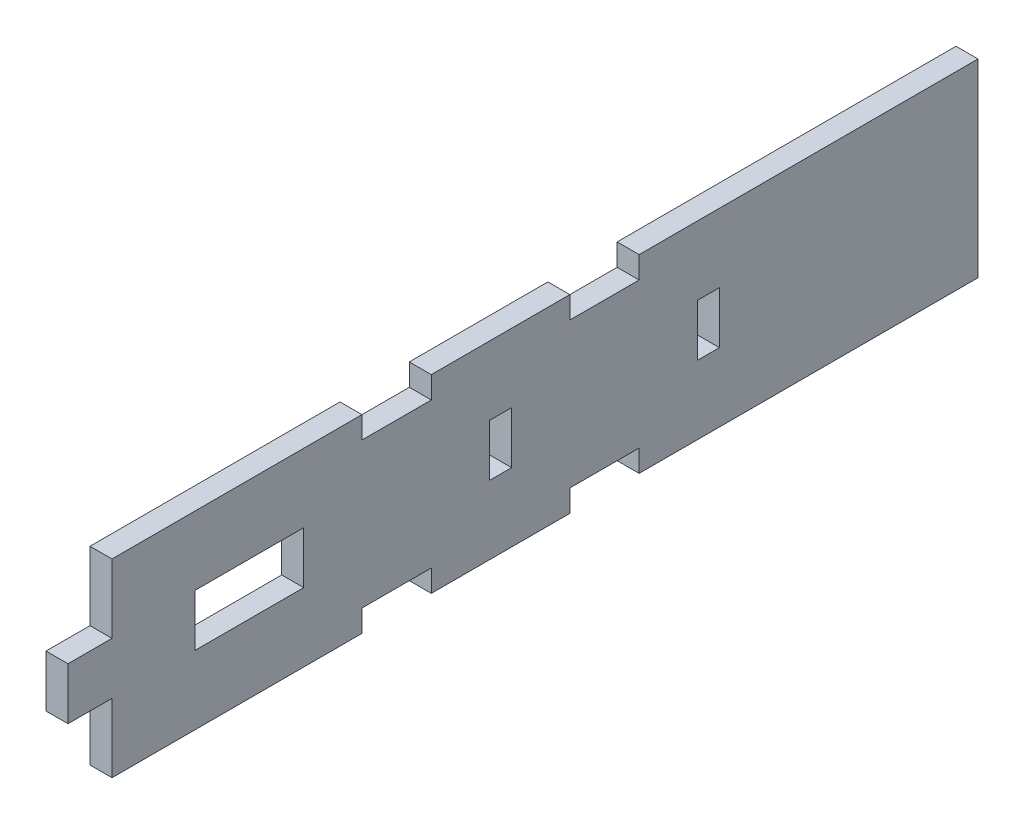
from build123d import *

# Parameters (mm, degrees)
SKETCH1_W           = 250
SKETCH1_H           = 54.7
SKETCH1_W_2         = 12.7
SKETCH1_H_2         = 15
BOSS_EXTRUDE1_DEPTH = 6.35
SKETCH2_W           = 6.35
SKETCH2_H           = 15
CUT_EXTRUDE1_DEPTH  = 141.533394608
LPATTERN1_COUNT     = 3
LPATTERN1_PITCH     = 60
SKETCH3_W           = 25
SKETCH3_H           = 15
CUT_EXTRUDE2_DEPTH  = 141.533394608
SKETCH4_W           = 20
SKETCH4_H           = 6.35
CUT_EXTRUDE3_DEPTH  = 141.533394608


with BuildPart() as part:
    # Sketch1 → Boss-Extrude1 (new body)
    with BuildSketch(Plane(origin=(0, 0, 0), x_dir=(0, 0, -1), z_dir=(1, 0, 0))):
        Rectangle(SKETCH1_W, SKETCH1_H)
        with Locations((-131.35, 0)):
            Rectangle(SKETCH1_W_2, SKETCH1_H_2)
    extrude(amount=BOSS_EXTRUDE1_DEPTH)

    # Sketch2 → Cut-Extrude1 (cut, through all)
    with BuildSketch(Plane(origin=(6.35, 0, 0), x_dir=(0, 0, -1), z_dir=(1, 0, 0))):
        with Locations((-72.825, 0)):
            Rectangle(SKETCH2_W, SKETCH2_H)
    cut_extrude1 = extrude(amount=-CUT_EXTRUDE1_DEPTH, mode=Mode.SUBTRACT)

    # LPattern1: Cut-Extrude1 ×3
    with Locations(*[(0, 0, -i * LPATTERN1_PITCH) for i in range(1, LPATTERN1_COUNT)]):
        add(cut_extrude1, mode=Mode.SUBTRACT)

    # Sketch3 → Cut-Extrude2 (cut, through all)
    with BuildSketch(Plane(origin=(6.35, 0, 0), x_dir=(0, 0, -1), z_dir=(1, 0, 0))):
        with Locations((-88.5, 0)):
            Rectangle(SKETCH3_W, SKETCH3_H)
    extrude(amount=-CUT_EXTRUDE2_DEPTH, mode=Mode.SUBTRACT)

    # Sketch4 → Cut-Extrude3 (cut, through all)
    with BuildSketch(Plane(origin=(6.35, 0, 0), x_dir=(0, 0, -1), z_dir=(1, 0, 0))):
        with Locations((-42.825, 24.175)):
            Rectangle(SKETCH4_W, SKETCH4_H)
        with Locations((17.175, 24.175)):
            Rectangle(SKETCH4_W, SKETCH4_H)
    cut_extrude3 = extrude(amount=-CUT_EXTRUDE3_DEPTH, mode=Mode.SUBTRACT)

    # Mirror1: Cut-Extrude3 across plane
    add(cut_extrude3.mirror(Plane.ZX), mode=Mode.SUBTRACT)


solid = part.part
